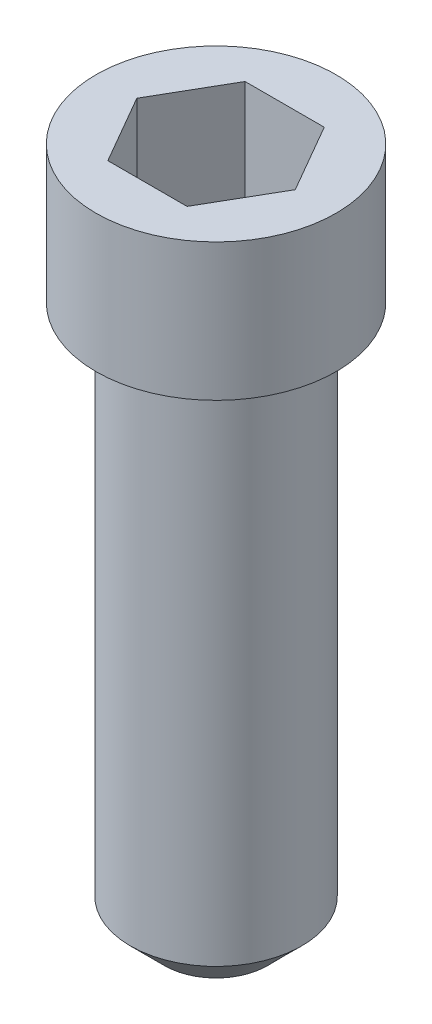
from build123d import *

# Parameters (mm, degrees)
SKETCH1_R           = 2.5
BOSS_EXTRUDE1_DEPTH = 16
SKETCH2_R           = 3.5
BOSS_EXTRUDE2_DEPTH = 4
CHAMFER1_SIZE       = 1
CUT_EXTRUDE1_DEPTH  = 3


with BuildPart() as part:
    # Sketch1 → Boss-Extrude1 (new body)
    with BuildSketch(Plane(origin=(0, 0, 0), x_dir=(1, 0, 0), z_dir=(0, 1, 0))):
        with Locations(Location((0, 0, 0), (0, 0, 270))):
            Circle(SKETCH1_R)
    extrude(amount=BOSS_EXTRUDE1_DEPTH)

    # Sketch2 → Boss-Extrude2 (add)
    with BuildSketch(Plane(origin=(0, 16, 0), x_dir=(1, 0, 0), z_dir=(0, 1, 0))):
        with Locations(Location((0, 0, 0), (0, 0, 270))):
            Circle(SKETCH2_R)
    extrude(amount=BOSS_EXTRUDE2_DEPTH)

    # Chamfer1
    chamfer1_edges = [part.edges().sort_by_distance(p)[0] for p in [
        (0, 0, -2.5),
    ]]
    chamfer(chamfer1_edges, length=CHAMFER1_SIZE)

    # Sketch3 → Cut-Extrude1 (cut)
    with BuildSketch(Plane(origin=(0, 20, 0), x_dir=(1, 0, 0), z_dir=(0, 1, 0))):
        Polygon((2.309401077, 0), (1.154700538, 2), (-1.154700538, 2), (-2.309401077, 0), (-1.154700538, -2), (1.154700538, -2), align=None)
    extrude(amount=-CUT_EXTRUDE1_DEPTH, mode=Mode.SUBTRACT)


solid = part.part
